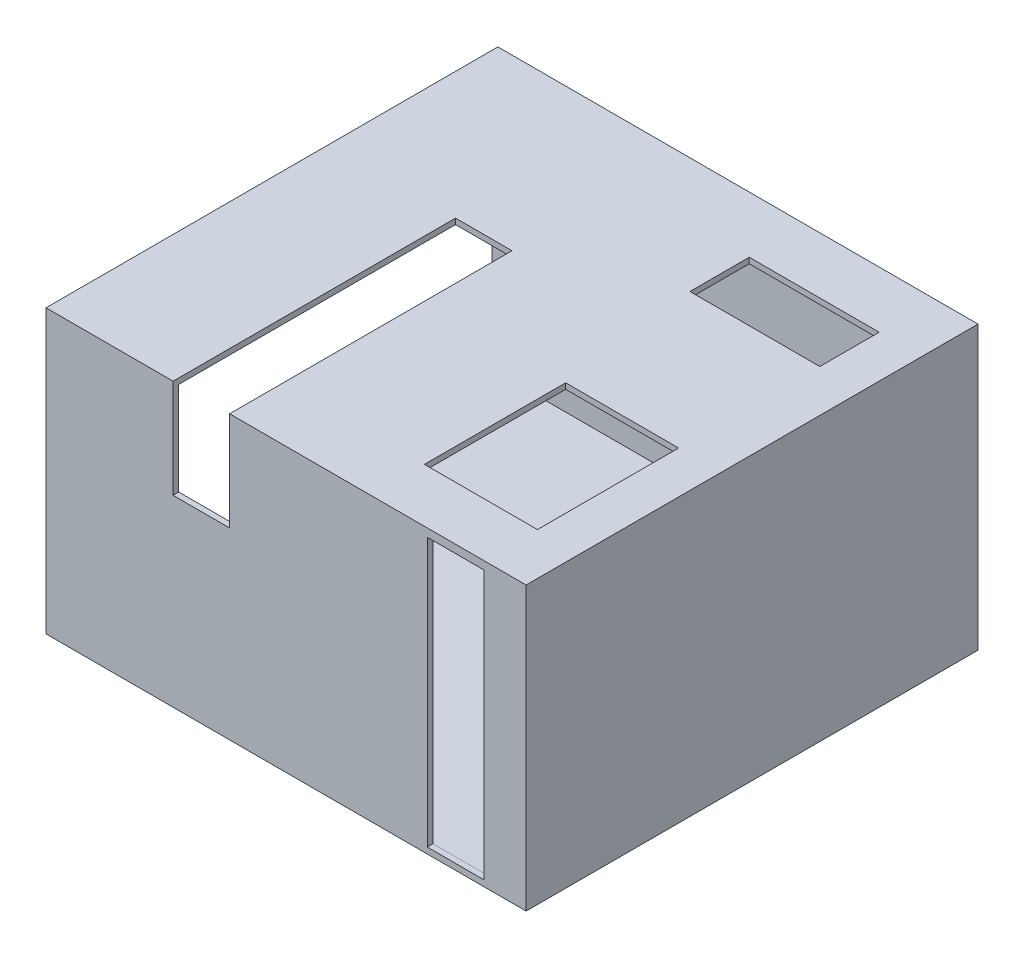
from build123d import *

# Parameters (mm, degrees)
SKETCH1_W           = 200
SKETCH1_H           = 100
BOSS_EXTRUDE1_DEPTH = 160
SHELL3_T            = -2
SKETCH2_W           = 46
SKETCH2_H           = 21
SKETCH2_W_2         = 40
SKETCH2_H_2         = 50
CUT_EXTRUDE1_DEPTH  = 68
SKETCH4_W           = 20
SKETCH4_H           = 95
CUT_EXTRUDE2_DEPTH  = 18
SKETCH6_W           = 20
SKETCH6_H           = 100
CUT_EXTRUDE3_DEPTH  = 35
SKETCH8_W           = 167.837082792
SKETCH8_H           = 105.374637329
CUT_EXTRUDE4_DEPTH  = 30


with BuildPart() as part:
    # Sketch1 → Boss-Extrude1 (new body)
    with BuildSketch(Plane.XY):
        with Locations((32.679929783, -17.656524283)):
            Rectangle(SKETCH1_W, SKETCH1_H)
    extrude(amount=BOSS_EXTRUDE1_DEPTH)

    # Shell3
    shell3_openings = [part.faces().sort_by_distance(p)[0] for p in [
        (-67.320070217, -17.656524283, 80),
    ]]
    offset(amount=SHELL3_T, openings=shell3_openings, kind=Kind.INTERSECTION)

    # Sketch2 → Cut-Extrude1 (cut)
    with BuildSketch(Plane(origin=(0, 32.343475717, 0), x_dir=(1, 0, 0), z_dir=(0, 1, 0))):
        with Locations((94.679929783, -30.5)):
            Rectangle(SKETCH2_W, SKETCH2_H)
        with Locations((97.679929783, -116)):
            Rectangle(SKETCH2_W_2, SKETCH2_H_2)
    extrude(amount=-CUT_EXTRUDE1_DEPTH, mode=Mode.SUBTRACT)

    # Sketch4 → Cut-Extrude2 (cut)
    with BuildSketch(Plane.XY.offset(160)):
        with Locations((107.679929783, -18.012169352)):
            Rectangle(SKETCH4_W, SKETCH4_H)
    extrude(amount=-CUT_EXTRUDE2_DEPTH, mode=Mode.SUBTRACT)

    # Sketch6 → Cut-Extrude3 (cut)
    with BuildSketch(Plane(origin=(0, 32.343475717, 0), x_dir=(1, 0, 0), z_dir=(0, 1, 0))):
        with Locations((17.679929783, -110)):
            Rectangle(SKETCH6_W, SKETCH6_H)
    extrude(amount=-CUT_EXTRUDE3_DEPTH, mode=Mode.SUBTRACT)

    # Sketch8 → Cut-Extrude4 (cut)
    with BuildSketch(Plane.ZY.offset(67.320070217)):
        with Locations((79.323733366, -18.148354562)):
            Rectangle(SKETCH8_W, SKETCH8_H)
    extrude(amount=-CUT_EXTRUDE4_DEPTH, mode=Mode.SUBTRACT)


solid = part.part
